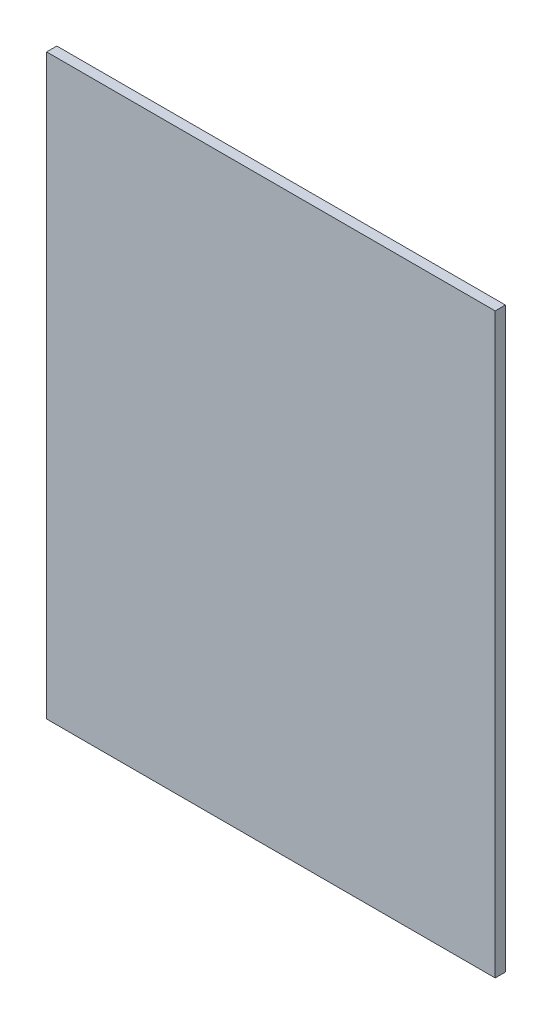
from build123d import *

# Parameters (mm, degrees)
SKETCH1_W           = 838.2
SKETCH1_H           = 1079.5
BOSS_EXTRUDE1_DEPTH = 19.05


with BuildPart() as part:
    # Sketch1 → Boss-Extrude1 (new body)
    with BuildSketch(Plane.XY):
        with Locations((383.272169404, 477.115735001)):
            Rectangle(SKETCH1_W, SKETCH1_H)
    extrude(amount=BOSS_EXTRUDE1_DEPTH)


solid = part.part
